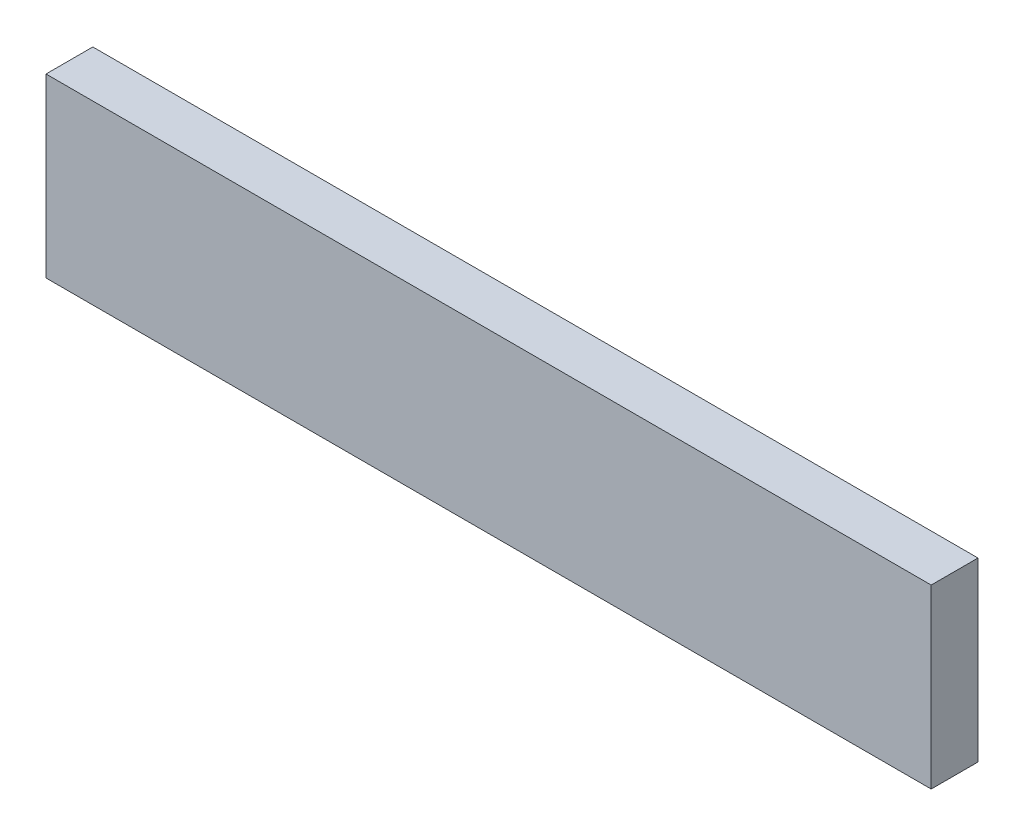
from build123d import *

# Parameters (mm, degrees)
SKETCH1_W           = 0.265
SKETCH1_H           = 1
BOSS_EXTRUDE1_DEPTH = 2.505


with BuildPart() as part:
    # Sketch1 → Boss-Extrude1 (new, symmetric)
    with BuildSketch(Plane(origin=(0, 0, 0), x_dir=(0, 0, -1), z_dir=(1, 0, 0))):
        Rectangle(SKETCH1_W, SKETCH1_H)
    extrude(amount=BOSS_EXTRUDE1_DEPTH, both=True)


solid = part.part
